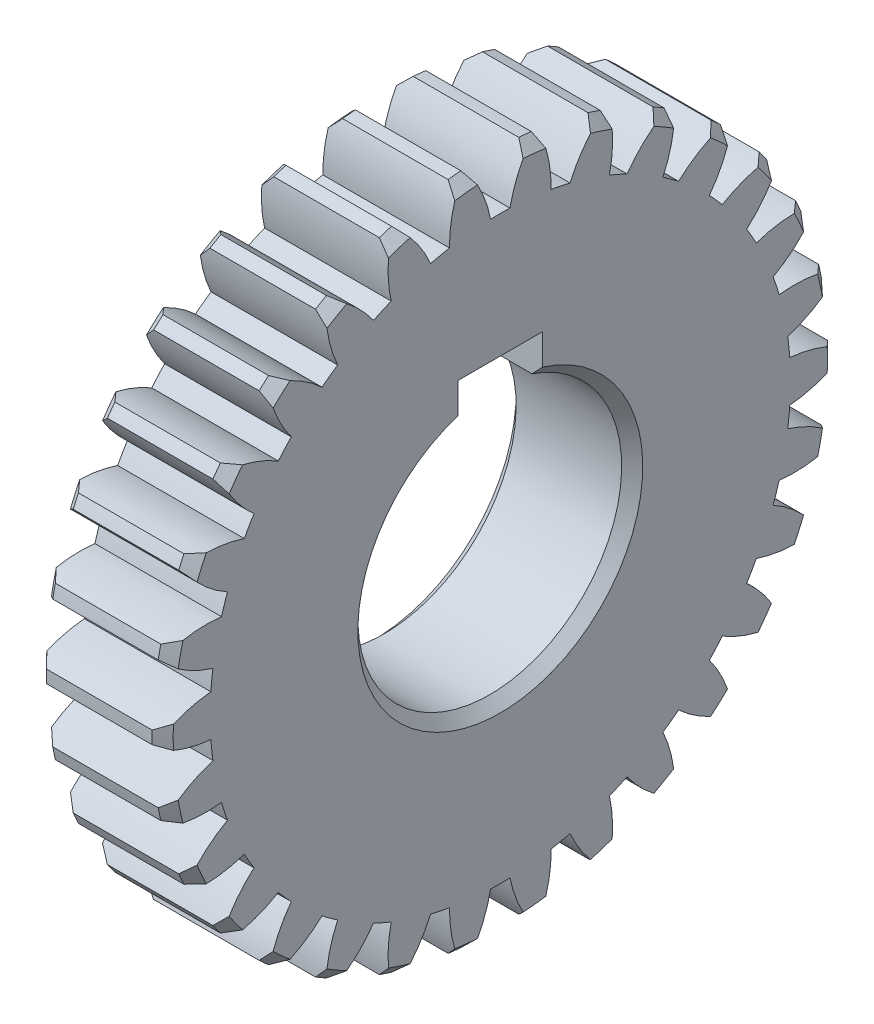
from build123d import *

# Parameters (mm, degrees)
BASPROSKE_W     = 12
BASPROSKE_H     = 32
TOOTHCUT_DEPTH  = 47.818799643
TEETHCUTS_COUNT = 30
TEETHCUTS_ANGLE = 348
BORSKE_R        = 12.5
BORE_DEPTH      = 50.0000508
KEYSKE_W        = 8
KEYSKE_H        = 15.8
KEYWAY_DEPTH    = 50.0000508
CHAMFER1_SIZE   = 1
CHAMFER2_SIZE   = 1


with BuildPart() as part:
    # BasProSke → Base-Revolve (revolve)
    with BuildSketch(Plane(origin=(0, 0, 0), x_dir=(1, 0, 0), z_dir=(0, 1, 0)), mode=Mode.PRIVATE) as base_revolve_sk:
        with Locations((6, 16)):
            Rectangle(BASPROSKE_W, BASPROSKE_H)
    revolve(base_revolve_sk.sketch.rotate(Axis((-10, 0, 0), (1, 0, 0)), 180), axis=Axis((-10, 0, 0), (1, 0, 0)))

    # TooCutSke → ToothCut (cut, through all)
    with BuildSketch(Plane(origin=(0, 0, 0), x_dir=(0, 0, -1), z_dir=(1, 0, 0))):
        with BuildLine():
            ThreePointArc((0.918551563, 27.483654488), (0, 27.499), (-0.918551563, 27.483654488))
            ThreePointArc((-0.918551563, 27.483654488), (-1.617208176, 29.787801627), (-2.761784709, 31.906093311))
            ThreePointArc((-2.761784709, 31.906093311), (0, 32.0254), (2.761784709, 31.906093311))
            ThreePointArc((2.761784709, 31.906093311), (1.617208176, 29.787801627), (0.918551563, 27.483654488))
        make_face()
    toothcut = extrude(amount=TOOTHCUT_DEPTH, mode=Mode.SUBTRACT)

    # TeethCuts: ToothCut ×30 about axis
    teethcuts_axis = Axis((-10, 0, 0), (1, 0, 0))
    for i in range(1, TEETHCUTS_COUNT):
        add(toothcut.rotate(teethcuts_axis, i * TEETHCUTS_ANGLE / (TEETHCUTS_COUNT - 1)), mode=Mode.SUBTRACT)

    # BorSke → Bore (cut, symmetric)
    with BuildSketch(Plane(origin=(0, 0, 0), x_dir=(0, 0, -1), z_dir=(1, 0, 0))):
        with Locations(Location((0, 0, 0), (0, 0, 180))):
            Circle(BORSKE_R)
    extrude(amount=BORE_DEPTH, both=True, mode=Mode.SUBTRACT)

    # KeySke → Keyway (cut, symmetric)
    with BuildSketch(Plane(origin=(0, 0, 0), x_dir=(0, 0, -1), z_dir=(1, 0, 0))):
        with Locations((0, 7.9)):
            Rectangle(KEYSKE_W, KEYSKE_H)
    extrude(amount=KEYWAY_DEPTH, both=True, mode=Mode.SUBTRACT)

    # Chamfer1
    chamfer1_edges = [part.edges().sort_by_distance(p)[0] for p in [
        (0, -12.5, 0),
        (12, -12.5, 0),
    ]]
    chamfer(chamfer1_edges, length=CHAMFER1_SIZE)

    # Chamfer2
    chamfer2_edges = [part.edges().sort_by_distance(p)[0] for p in [
        (12, 30.433808521, -9.88854382),
        (12, 27.712812921, -16),
        (12, 23.780634415, -21.412179403),
        (12, 18.809128073, -25.88854382),
        (12, 13.015572578, -29.233454645),
        (12, 6.653174106, -31.300723223),
        (12, 0, -32),
        (12, -6.653174106, -31.300723223),
        (12, -13.015572578, -29.233454645),
        (12, -18.809128073, -25.88854382),
        (12, -23.780634415, -21.412179403),
        (12, -27.712812921, -16),
        (12, 31.824700652, -3.344910825),
        (12, -30.433808521, -9.88854382),
        (12, -31.824700652, -3.344910825),
        (12, -31.824700652, 3.344910825),
        (12, -30.433808521, 9.88854382),
        (12, -27.712812921, 16),
        (12, -23.780634415, 21.412179403),
        (12, -18.809128073, 25.88854382),
        (12, -13.015572578, 29.233454645),
        (12, -6.653174106, 31.300723223),
        (12, 0, 32),
        (12, 6.653174106, 31.300723223),
        (12, 13.015572578, 29.233454645),
        (12, 18.809128073, 25.88854382),
        (12, 23.780634415, 21.412179403),
        (12, 27.712812921, 16),
        (12, 30.433808521, 9.88854382),
        (0, 31.824700652, 3.344910825),
        (12, 31.824700652, 3.344910825),
        (0, 30.433808521, -9.88854382),
        (0, 27.712812921, -16),
        (0, 23.780634415, -21.412179403),
        (0, 18.809128073, -25.88854382),
        (0, 13.015572578, -29.233454645),
        (0, 6.653174106, -31.300723223),
        (0, 0, -32),
        (0, -6.653174106, -31.300723223),
        (0, -13.015572578, -29.233454645),
        (0, -18.809128073, -25.88854382),
        (0, -23.780634415, -21.412179403),
        (0, -27.712812921, -16),
        (0, -30.433808521, -9.88854382),
        (0, -31.824700652, -3.344910825),
        (0, -31.824700652, 3.344910825),
        (0, -30.433808521, 9.88854382),
        (0, -27.712812921, 16),
        (0, -23.780634415, 21.412179403),
        (0, -18.809128073, 25.88854382),
        (0, -13.015572578, 29.233454645),
        (0, -6.653174106, 31.300723223),
        (0, 0, 32),
        (0, 6.653174106, 31.300723223),
        (0, 13.015572578, 29.233454645),
        (0, 18.809128073, 25.88854382),
        (0, 23.780634415, 21.412179403),
        (0, 27.712812921, 16),
        (0, 30.433808521, 9.88854382),
        (0, 31.824700652, -3.344910825),
    ]]
    chamfer(chamfer2_edges, length=CHAMFER2_SIZE)


solid = part.part
